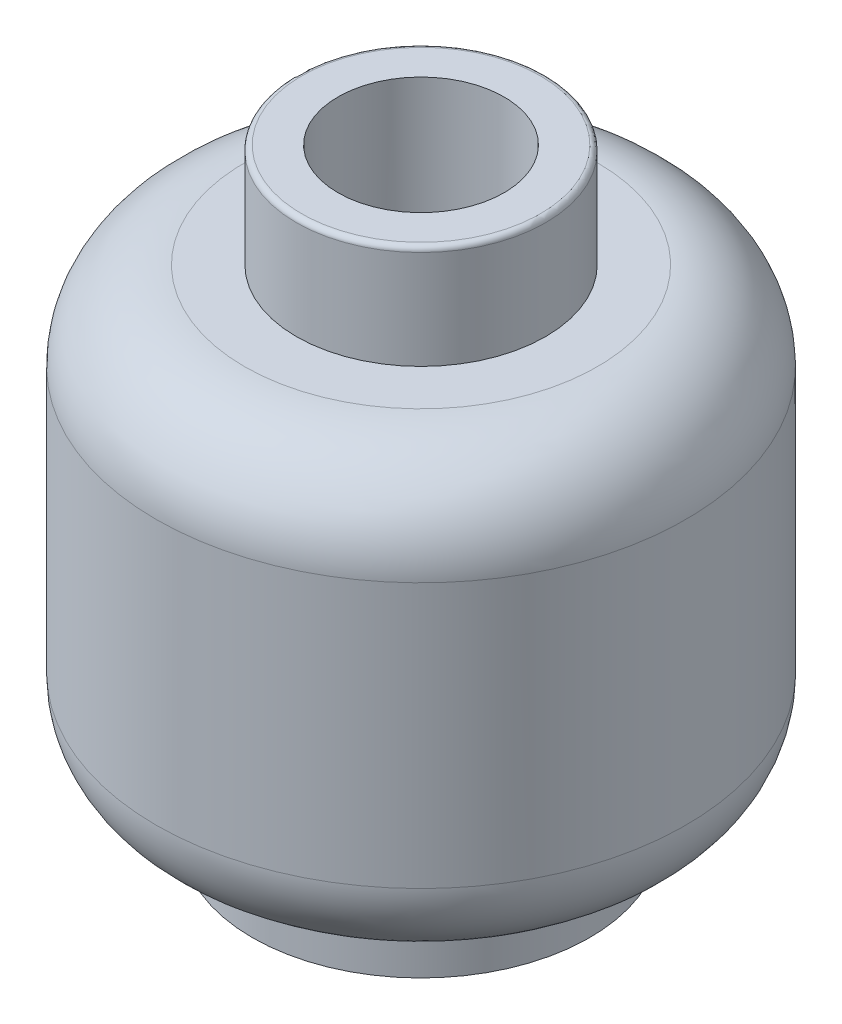
from build123d import *

# Parameters (mm, degrees)
FILLET1_R          = 1.7
SKETCH2_R          = 1.6
CUT_EXTRUDE1_DEPTH = 2
CUT_EXTRUDE2_DEPTH = 13.0074977
SKETCH4_R          = 2.45
CUT_EXTRUDE3_DEPTH = 8.5
FILLET2_R          = 0.1


with BuildPart() as part:
    # Sketch1 → Revolve1 (revolve)
    with BuildSketch(Plane.XY, mode=Mode.PRIVATE) as revolve1_sk:
        Polygon((0, 11.6), (2.4, 11.6), (2.4, 9.6), (5.1, 9.6), (5.1, 1.1), (3.25, 1.1), (3.25, 0), (0, 0), align=None)
    revolve(revolve1_sk.sketch.rotate(Axis((0, 161.315789474, 0), (0, -1, 0)), 90), axis=Axis((0, 161.315789474, 0), (0, -1, 0)))

    # Fillet1
    fillet1_edges = [part.edges().sort_by_distance(p)[0] for p in [
        (0, 1.1, -5.1),
        (0, 9.6, -5.1),
    ]]
    fillet(fillet1_edges, radius=FILLET1_R)

    # Sketch2 → Cut-Extrude1 (cut)
    with BuildSketch(Plane(origin=(0, 11.6, 0), x_dir=(1, 0, 0), z_dir=(0, 1, 0))):
        with Locations(Location((0, 0, 0), (0, 0, 270))):
            Circle(SKETCH2_R)
    extrude(amount=-CUT_EXTRUDE1_DEPTH, mode=Mode.SUBTRACT)

    # Sketch3 → Cut-Extrude2 (cut, through all)
    with BuildSketch(Plane(origin=(0, 9.6, 0), x_dir=(1, 0, 0), z_dir=(0, 1, 0))):
        with BuildLine():
            Line((-0.42, 0.242487113), (-0.42, 1.543891188))
            ThreePointArc((-0.42, 1.543891188), (-1.385640646, 0.8), (-1.547048989, -0.408214924))
            Line((-1.547048989, -0.408214924), (-0.42, 0.242487113))
        make_face()
        with BuildLine():
            ThreePointArc((1.6, 0), (1.271219887, 0.971596624), (0.42, 1.543891188))
            Line((0.42, 1.543891188), (0.42, 0.242487113))
            Line((0.42, 0.242487113), (1.547048989, -0.408214924))
            ThreePointArc((1.547048989, -0.408214924), (1.586707028, -0.205817415), (1.6, 0))
        make_face()
        with BuildLine():
            Line((0, -0.484974226), (-1.127048989, -1.135676264))
            ThreePointArc((-1.127048989, -1.135676264), (0, -1.6), (1.127048989, -1.135676264))
            Line((1.127048989, -1.135676264), (0, -0.484974226))
        make_face()
    extrude(amount=-CUT_EXTRUDE2_DEPTH, mode=Mode.SUBTRACT)

    # Sketch4 → Cut-Extrude3 (cut)
    with BuildSketch(Plane.XZ):
        with Locations(Location((0, 0, 0), (0, 0, 270))):
            Circle(SKETCH4_R)
    extrude(amount=-CUT_EXTRUDE3_DEPTH, mode=Mode.SUBTRACT)

    # Fillet2
    fillet2_edges = [part.edges().sort_by_distance(p)[0] for p in [
        (0, 11.6, -2.4),
    ]]
    fillet(fillet2_edges, radius=FILLET2_R)


solid = part.part
